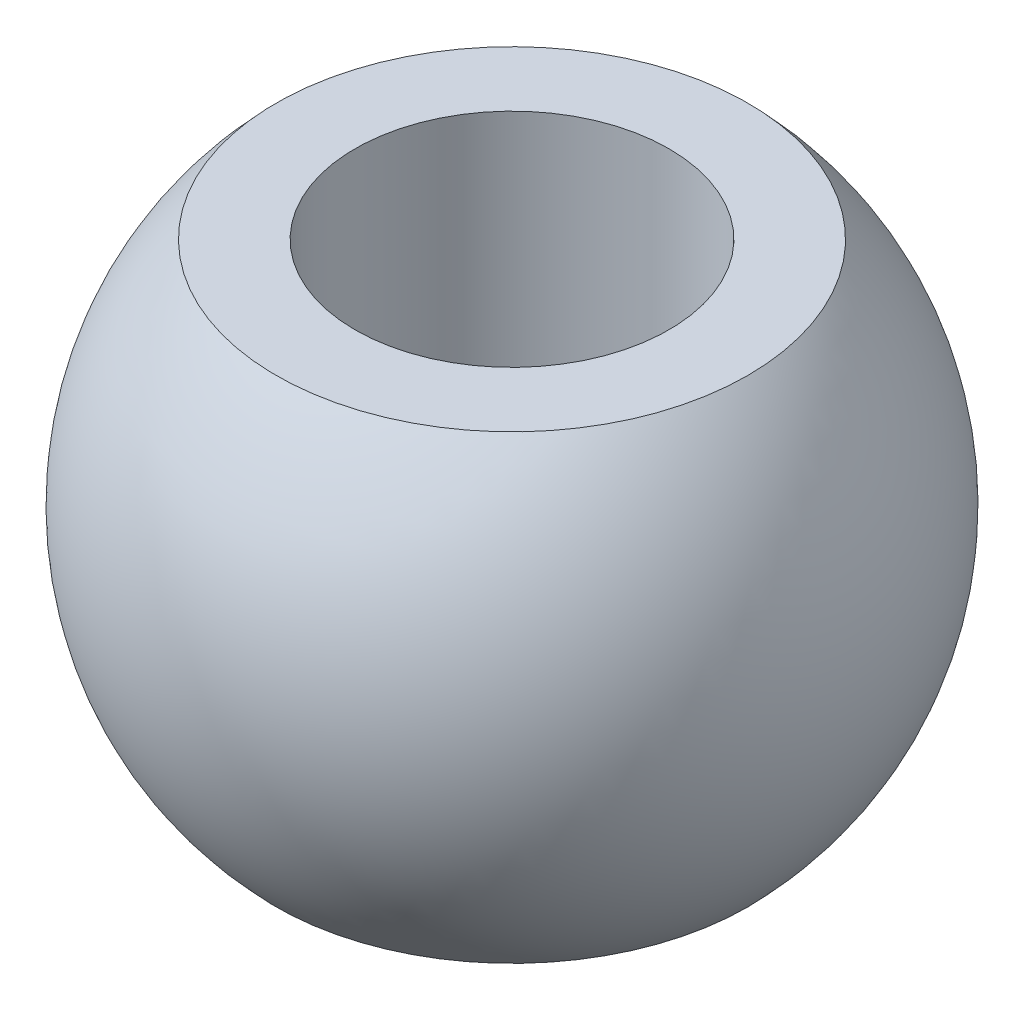
from build123d import *


with BuildPart() as part:
    # Sketch1 → Revolve1 (revolve)
    with BuildSketch(Plane.XY):
        with BuildLine():
            Line((2.254440064, 2.2), (1.5, 2.2))
            Line((1.5, 2.2), (1.5, -2.2))
            Line((1.5, -2.2), (2.254440064, -2.2))
            ThreePointArc((2.254440064, -2.2), (3.15, 0), (2.254440064, 2.2))
        make_face()
    revolve(axis=Axis((0, 2.055910493, 0), (0, -1, 0)))


solid = part.part
